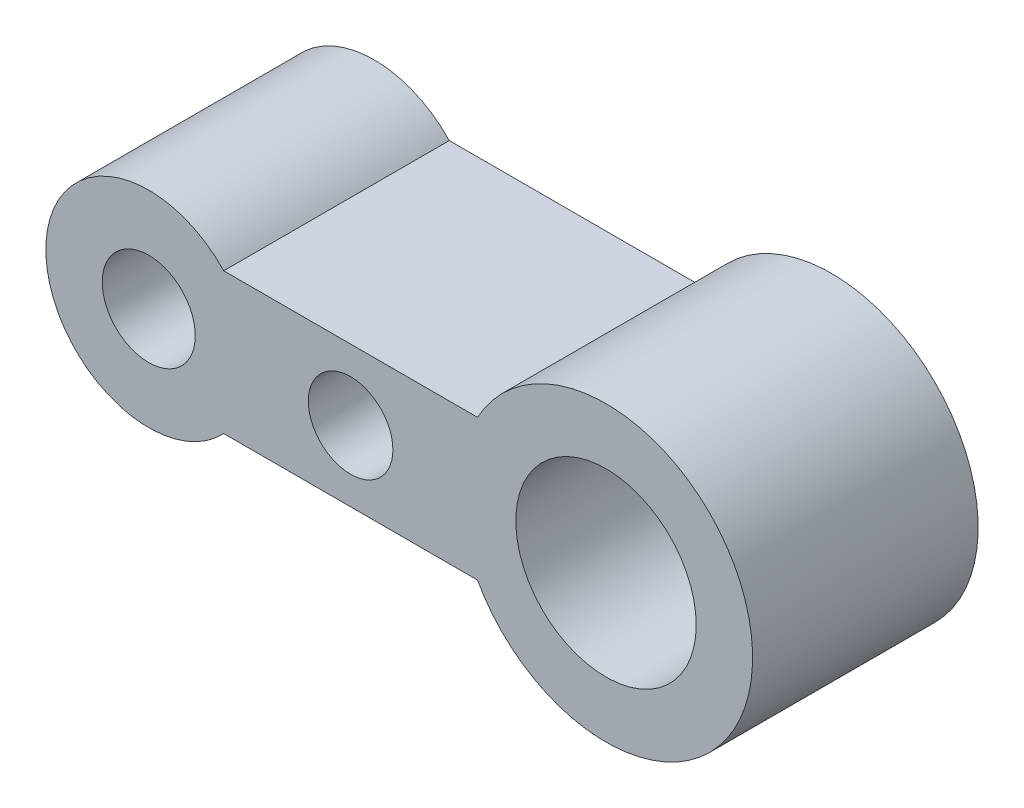
from build123d import *

# Parameters (mm, degrees)
CROQUIS1_R              = 3.2
CROQUIS1_R_2            = 1.65
SALIENTE_EXTRUIR1_DEPTH = 8
CROQUIS3_R              = 1.5
CORTAR_EXTRUIR1_DEPTH   = 21.5


with BuildPart() as part:
    # Croquis1 → Saliente-Extruir1 (new body)
    with BuildSketch(Plane.XY):
        with BuildLine():
            Line((11.659417229, 2.5), (2.659417229, 2.5))
            ThreePointArc((2.659417229, 2.5), (-3.65, 0), (2.659417229, -2.5))
            Line((2.659417229, -2.5), (11.659417229, -2.5))
            ThreePointArc((11.659417229, -2.5), (21.419022475, 0), (11.659417229, 2.5))
        make_face()
        with Locations((16.219022475, 0)):
            Circle(CROQUIS1_R, mode=Mode.SUBTRACT)
        Circle(CROQUIS1_R_2, mode=Mode.SUBTRACT)
    extrude(amount=SALIENTE_EXTRUIR1_DEPTH)

    # Croquis3 → Cortar-Extruir1 (cut)
    with BuildSketch(Plane(origin=(0, 0, 0), x_dir=(-1, 0, 0), z_dir=(0, 0, -1))):
        with Locations((-7.159417229, 0)):
            Circle(CROQUIS3_R)
    extrude(amount=-CORTAR_EXTRUIR1_DEPTH, mode=Mode.SUBTRACT)


solid = part.part
